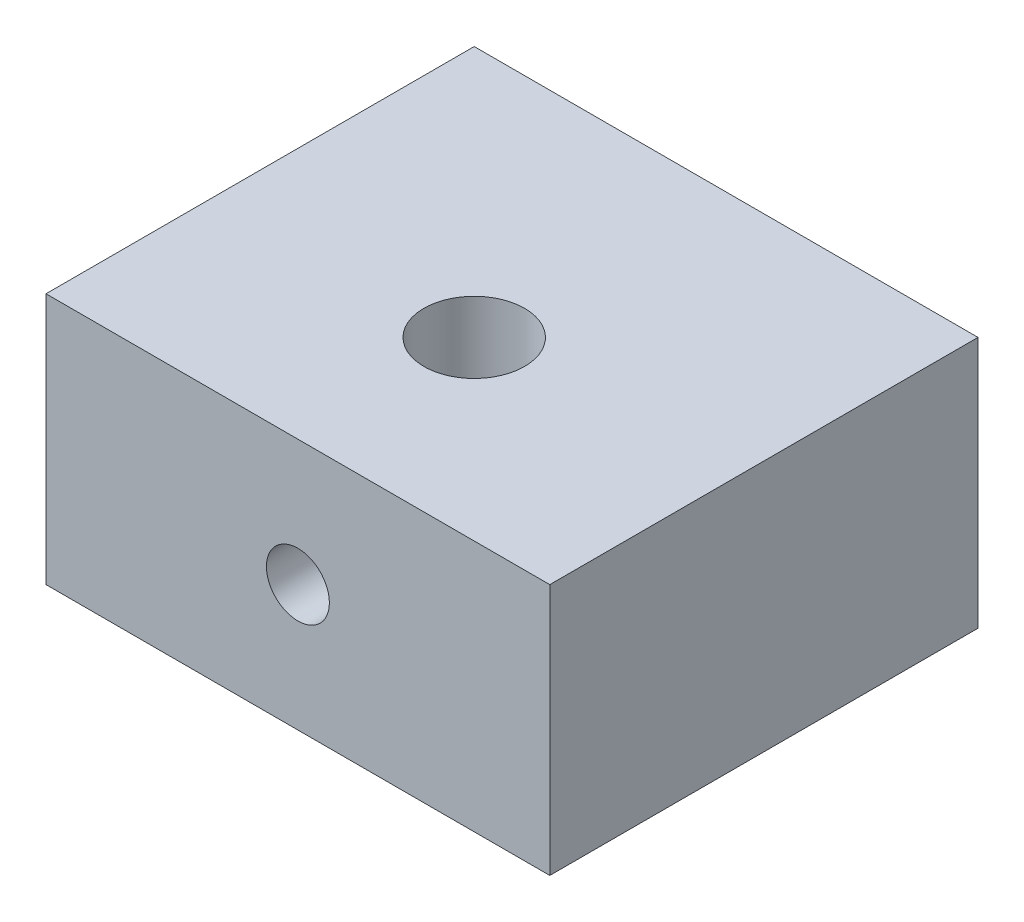
from build123d import *

# Parameters (mm, degrees)
SKETCH_1_W          = 20
SKETCH_1_H          = 10
EXTRUDE_1_DEPTH     = 17
SKETCH_2_R          = 2
CUT_EXTRUDE_1_DEPTH = 29.08914381
M3X0_5_1_D          = 2.5
M3X0_5_1_DEPTH      = 12.5
M3X0_5_1_TIP        = 0.751075774
M3X0_5_2_REACH      = 30.089
M3X0_5_2_BORE_R     = 1.25


with BuildPart() as part:
    # ｽｹｯﾁ1 → ﾎﾞｽ - 押し出し1 (new body)
    with BuildSketch(Plane.XY):
        with Locations((10, 5)):
            Rectangle(SKETCH_1_W, SKETCH_1_H)
    extrude(amount=EXTRUDE_1_DEPTH)

    # ｽｹｯﾁ2 → ｶｯﾄ - 押し出し1 (cut, through all)
    with BuildSketch(Plane.XZ):
        with Locations(Location((10, 10, 0), (0, 0, 270))):
            Circle(SKETCH_2_R)
    extrude(amount=-CUT_EXTRUDE_1_DEPTH, mode=Mode.SUBTRACT)

    # M3x0.5 ねじ穴1
    with Locations(Plane(origin=(0, 0, 0), x_dir=(-1, 0, 0), z_dir=(0, 0, -1))):
        with Locations((-5, 5), (-15, 5)):
            Hole(M3X0_5_1_D / 2, depth=M3X0_5_1_DEPTH)
            with Locations((0, 0, -(M3X0_5_1_DEPTH + M3X0_5_1_TIP / 2))):  # 118° drill point
                Cone(0, M3X0_5_1_D / 2, M3X0_5_1_TIP, mode=Mode.SUBTRACT)

    # M3x0.5 ねじ穴2 bore → M3x0.5 ねじ穴2 (cut, up to next)
    with BuildSketch(Plane.XY.offset(17), mode=Mode.PRIVATE) as m3x0_5_2_sk1:
        with Locations((10, 5)):
            Circle(M3X0_5_2_BORE_R)
    m3x0_5_2_tool1 = extrude(m3x0_5_2_sk1.sketch, amount=-M3X0_5_2_REACH, mode=Mode.PRIVATE) & part.part
    add(m3x0_5_2_tool1.solids().sort_by_distance((10, 5, 17))[0], mode=Mode.SUBTRACT)


solid = part.part
